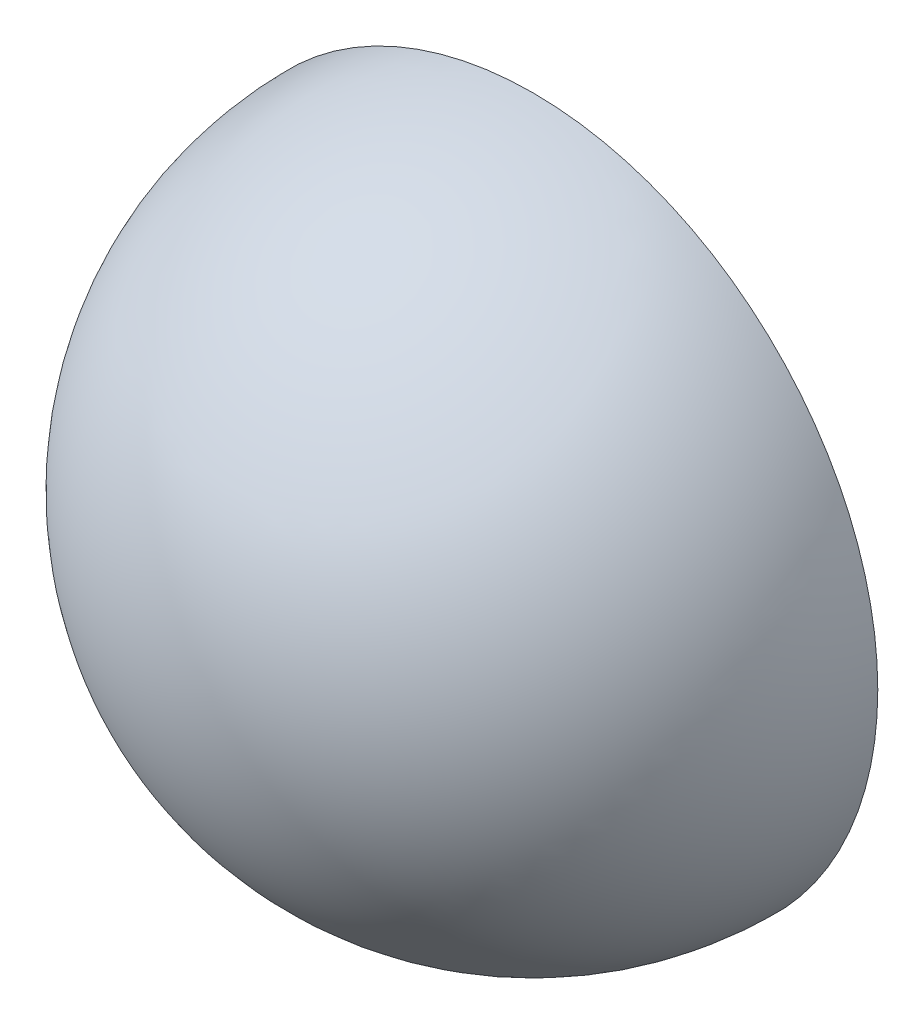
from build123d import *

# Parameters (mm, degrees)
SKETCH2_R          = 1.255
CUT_EXTRUDE1_DEPTH = 1.5


with BuildPart() as part:
    # Sketch1 → Revolve1 (revolve)
    with BuildSketch(Plane(origin=(0, 0, 0), x_dir=(0, 0, -1), z_dir=(1, 0, 0))):
        with BuildLine():
            Line((0, 0), (0, 2.5))
            ThreePointArc((0, 2.5), (-1.767766953, 1.767766953), (-2.5, 0))
            Line((-2.5, 0), (0, 0))
        make_face()
    revolve(axis=Axis((0, 0, 0), (0, 0, 1)))

    # Sketch2 → Cut-Extrude1 (cut)
    with BuildSketch(Plane(origin=(0, 0, 0), x_dir=(-1, 0, 0), z_dir=(0, 0, -1))):
        Circle(SKETCH2_R)
    extrude(amount=-CUT_EXTRUDE1_DEPTH, mode=Mode.SUBTRACT)


solid = part.part
